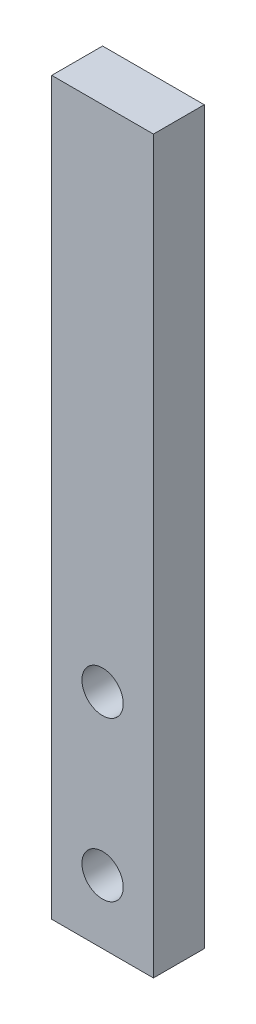
from build123d import *

# Parameters (mm, degrees)
SKETCH1_W           = 16
SKETCH1_H           = 115
BOSS_EXTRUDE1_DEPTH = 8
SKETCH2_R           = 3.25
CUT_EXTRUDE1_DEPTH  = 59.60247435


with BuildPart() as part:
    # Sketch1 → Boss-Extrude1 (new body)
    with BuildSketch(Plane.XY):
        Rectangle(SKETCH1_W, SKETCH1_H)
    extrude(amount=BOSS_EXTRUDE1_DEPTH)

    # Sketch2 → Cut-Extrude1 (cut, through all)
    with BuildSketch(Plane.XY.offset(8)):
        with Locations((0, -22.5)):
            Circle(SKETCH2_R)
        with Locations((0, -47.5)):
            Circle(SKETCH2_R)
    extrude(amount=-CUT_EXTRUDE1_DEPTH, mode=Mode.SUBTRACT)


solid = part.part
